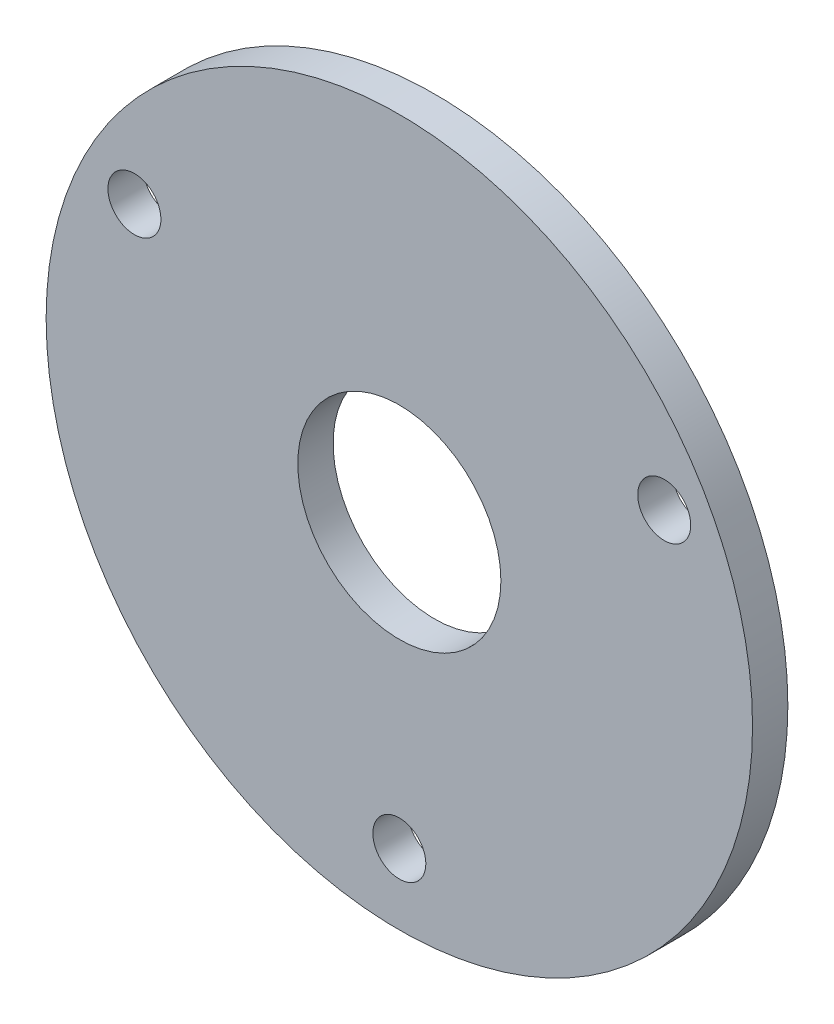
from build123d import *

# Parameters (mm, degrees)
CROQUIS1_R              = 20
CROQUIS1_R_2            = 1.5
SALIENTE_EXTRUIR1_DEPTH = 2
CROQUIS2_R              = 5.75
CORTAR_EXTRUIR1_DEPTH   = 10


with BuildPart() as part:
    # Croquis1 → Saliente-Extruir1 (new body)
    with BuildSketch(Plane.XY):
        Circle(CROQUIS1_R)
        with Locations((15, 8.1)):
            Circle(CROQUIS1_R_2, mode=Mode.SUBTRACT)
        with Locations((0, -16)):
            Circle(CROQUIS1_R_2, mode=Mode.SUBTRACT)
        with Locations(Location((-15, 8.1, 0), (0, 0, 180))):
            Circle(CROQUIS1_R_2, mode=Mode.SUBTRACT)
    extrude(amount=SALIENTE_EXTRUIR1_DEPTH)

    # Croquis2 → Cortar-Extruir1 (cut)
    with BuildSketch(Plane.XY.offset(2)):
        Circle(CROQUIS2_R)
    extrude(amount=-CORTAR_EXTRUIR1_DEPTH, mode=Mode.SUBTRACT)


solid = part.part
